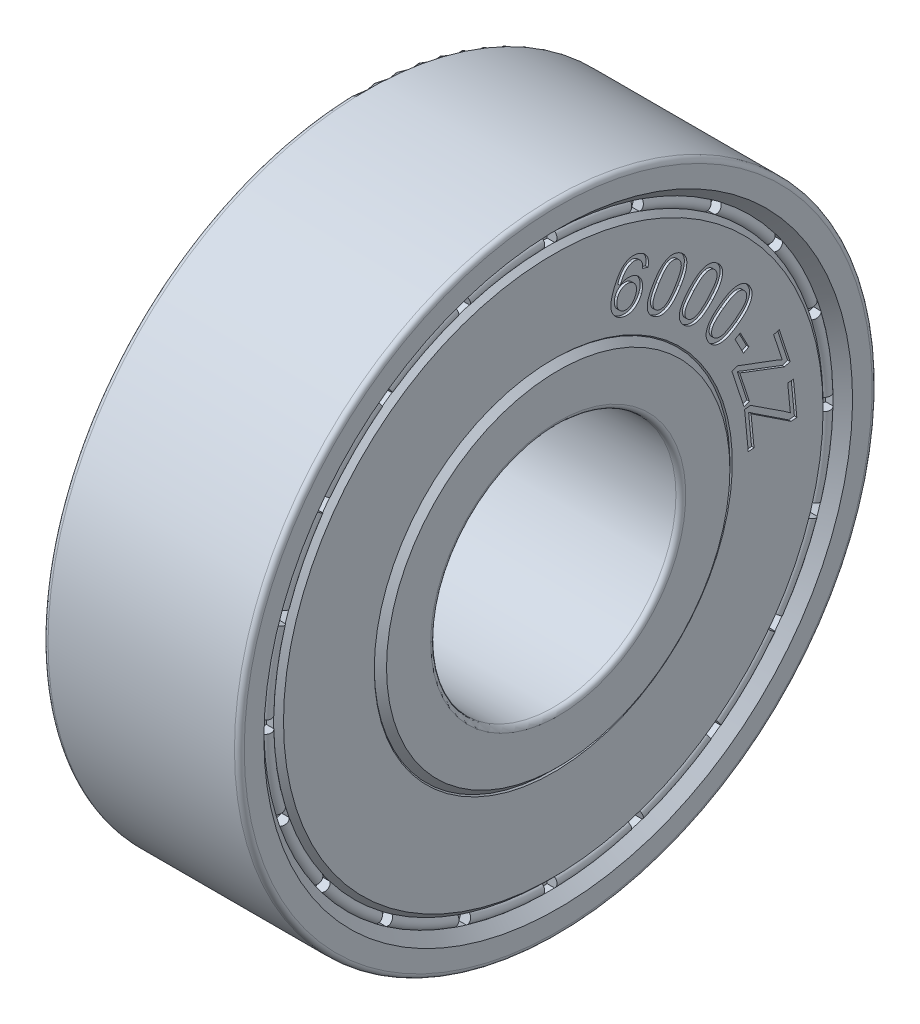
from build123d import *

# Parameters (mm, degrees)
FILLET_1_R                       = 0.2
CUT_EXTRUDE_1_DEPTH              = 0.5
PATTERN_CIRCULAR_1_COUNT         = 20
PATTERN_CIRCULAR_1_COPY_1_DEPTH  = 0.5
PATTERN_CIRCULAR_1_COPY_2_DEPTH  = 0.5
PATTERN_CIRCULAR_1_COPY_3_DEPTH  = 0.5
PATTERN_CIRCULAR_1_COPY_4_DEPTH  = 0.5
PATTERN_CIRCULAR_1_COPY_5_DEPTH  = 0.5
PATTERN_CIRCULAR_1_COPY_6_DEPTH  = 0.5
PATTERN_CIRCULAR_1_COPY_7_DEPTH  = 0.5
PATTERN_CIRCULAR_1_COPY_8_DEPTH  = 0.5
PATTERN_CIRCULAR_1_COPY_9_DEPTH  = 0.5
PATTERN_CIRCULAR_1_COPY_10_DEPTH = 0.5
PATTERN_CIRCULAR_1_COPY_11_DEPTH = 0.5
PATTERN_CIRCULAR_1_COPY_12_DEPTH = 0.5
PATTERN_CIRCULAR_1_COPY_13_DEPTH = 0.5
PATTERN_CIRCULAR_1_COPY_14_DEPTH = 0.5
PATTERN_CIRCULAR_1_COPY_15_DEPTH = 0.5
PATTERN_CIRCULAR_1_COPY_16_DEPTH = 0.5
PATTERN_CIRCULAR_1_COPY_17_DEPTH = 0.5
PATTERN_CIRCULAR_1_COPY_18_DEPTH = 0.5
PATTERN_CIRCULAR_1_COPY_19_DEPTH = 0.5
CUT_EXTRUDE_2_DEPTH              = 0.1


with BuildPart() as part:
    # Эскиз1 → Повернуть1 (revolve)
    with BuildSketch(Plane.XY, mode=Mode.PRIVATE) as revolve_1_sk:
        with BuildLine():
            Line((-4, 5), (4, 5))
            Line((4, 5), (4, 7))
            Line((4, 7), (3.75, 7.25))
            Line((3.75, 7.25), (3.8, 7.3))
            Line((3.8, 7.3), (3.8, 11))
            Line((3.8, 11), (3.6, 11.2))
            ThreePointArc((3.6, 11.2), (3.7, 11.4), (3.6, 11.6))
            Line((3.6, 11.6), (4, 12))
            Line((4, 12), (4, 13))
            Line((4, 13), (-4, 13))
            Line((-4, 13), (-4, 12))
            Line((-4, 12), (-3.6, 11.6))
            ThreePointArc((-3.6, 11.6), (-3.7, 11.4), (-3.6, 11.2))
            Line((-3.6, 11.2), (-3.8, 11))
            Line((-3.8, 11), (-3.8, 7.3))
            Line((-3.8, 7.3), (-3.75, 7.25))
            Line((-3.75, 7.25), (-4, 7))
            Line((-4, 7), (-4, 5))
        make_face()
    revolve(revolve_1_sk.sketch.rotate(Axis((-17.019189765, 0, 0), (1, 0, 0)), 90), axis=Axis((-17.019189765, 0, 0), (1, 0, 0)))

    # Скругление1
    fillet_1_edges = [part.edges().sort_by_distance(p)[0] for p in [
        (-4, 0, -13),
        (4, 0, -13),
        (4, 0, -5),
        (-4, 0, -5),
    ]]
    fillet(fillet_1_edges, radius=FILLET_1_R)

    # Эскиз2 → Вырез-Вытянуть1 (cut)
    with BuildSketch(Plane.ZY.offset(3.8)):
        with BuildLine():
            Line((-0.25, 11.597305722), (-0.25, 11.197209474))
            ThreePointArc((-0.25, 11.197209474), (0, 11.2), (0.25, 11.197209474))
            Line((0.25, 11.197209474), (0.25, 11.597305722))
            ThreePointArc((0.25, 11.597305722), (0, 11.6), (-0.25, 11.597305722))
        make_face()
    cut_extrude_1 = extrude(amount=-CUT_EXTRUDE_1_DEPTH, mode=Mode.SUBTRACT)

    # Зеркальное отражение1: Вырез-Вытянуть1 across plane
    add(cut_extrude_1.mirror(Plane(origin=(0, 0, 0), x_dir=(0, 0, 1), z_dir=(1, 0, 0))), mode=Mode.SUBTRACT)

    # Круговой массив1: Вырез-Вытянуть1 ×20 about axis
    pattern_circular_1_axis = Axis((0, 0, 0), (1, 0, 0))
    for i in range(1, PATTERN_CIRCULAR_1_COUNT):
        add(cut_extrude_1.rotate(pattern_circular_1_axis, i * 360 / PATTERN_CIRCULAR_1_COUNT), mode=Mode.SUBTRACT)

    # Круговой массив1 copy 1 sketch → Круговой массив1 copy 1 (cut)
    with BuildSketch(Plane(origin=(3.8, 0, 0), x_dir=(0, -0.3090169943749474, 0.9510565162951535), z_dir=(1, 0, 0))):
        with BuildLine():
            Line((-0.25, -11.597305722), (-0.25, -11.197209474))
            ThreePointArc((-0.25, -11.197209474), (0, -11.2), (0.25, -11.197209474))
            Line((0.25, -11.197209474), (0.25, -11.597305722))
            ThreePointArc((0.25, -11.597305722), (0, -11.6), (-0.25, -11.597305722))
        make_face()
    extrude(amount=-PATTERN_CIRCULAR_1_COPY_1_DEPTH, mode=Mode.SUBTRACT)

    # Круговой массив1 copy 2 sketch → Круговой массив1 copy 2 (cut)
    with BuildSketch(Plane(origin=(3.8, 0, 0), x_dir=(0, -0.5877852522924731, 0.8090169943749475), z_dir=(1, 0, 0))):
        with BuildLine():
            Line((-0.25, -11.597305722), (-0.25, -11.197209474))
            ThreePointArc((-0.25, -11.197209474), (0, -11.2), (0.25, -11.197209474))
            Line((0.25, -11.197209474), (0.25, -11.597305722))
            ThreePointArc((0.25, -11.597305722), (0, -11.6), (-0.25, -11.597305722))
        make_face()
    extrude(amount=-PATTERN_CIRCULAR_1_COPY_2_DEPTH, mode=Mode.SUBTRACT)

    # Круговой массив1 copy 3 sketch → Круговой массив1 copy 3 (cut)
    with BuildSketch(Plane(origin=(3.8, 0, 0), x_dir=(0, -0.8090169943749475, 0.5877852522924731), z_dir=(1, 0, 0))):
        with BuildLine():
            Line((-0.25, -11.597305722), (-0.25, -11.197209474))
            ThreePointArc((-0.25, -11.197209474), (0, -11.2), (0.25, -11.197209474))
            Line((0.25, -11.197209474), (0.25, -11.597305722))
            ThreePointArc((0.25, -11.597305722), (0, -11.6), (-0.25, -11.597305722))
        make_face()
    extrude(amount=-PATTERN_CIRCULAR_1_COPY_3_DEPTH, mode=Mode.SUBTRACT)

    # Круговой массив1 copy 4 sketch → Круговой массив1 copy 4 (cut)
    with BuildSketch(Plane(origin=(3.8, 0, 0), x_dir=(0, -0.9510565162951535, 0.30901699437494745), z_dir=(1, 0, 0))):
        with BuildLine():
            Line((-0.25, -11.597305722), (-0.25, -11.197209474))
            ThreePointArc((-0.25, -11.197209474), (0, -11.2), (0.25, -11.197209474))
            Line((0.25, -11.197209474), (0.25, -11.597305722))
            ThreePointArc((0.25, -11.597305722), (0, -11.6), (-0.25, -11.597305722))
        make_face()
    extrude(amount=-PATTERN_CIRCULAR_1_COPY_4_DEPTH, mode=Mode.SUBTRACT)

    # Круговой массив1 copy 5 sketch → Круговой массив1 copy 5 (cut)
    with BuildSketch(Plane(origin=(3.8, 0, 0), x_dir=(0, -1, 0), z_dir=(1, 0, 0))):
        with BuildLine():
            Line((-0.25, -11.597305722), (-0.25, -11.197209474))
            ThreePointArc((-0.25, -11.197209474), (0, -11.2), (0.25, -11.197209474))
            Line((0.25, -11.197209474), (0.25, -11.597305722))
            ThreePointArc((0.25, -11.597305722), (0, -11.6), (-0.25, -11.597305722))
        make_face()
    extrude(amount=-PATTERN_CIRCULAR_1_COPY_5_DEPTH, mode=Mode.SUBTRACT)

    # Круговой массив1 copy 6 sketch → Круговой массив1 copy 6 (cut)
    with BuildSketch(Plane(origin=(3.8, 0, 0), x_dir=(0, -0.9510565162951536, -0.30901699437494734), z_dir=(1, 0, 0))):
        with BuildLine():
            Line((-0.25, -11.597305722), (-0.25, -11.197209474))
            ThreePointArc((-0.25, -11.197209474), (0, -11.2), (0.25, -11.197209474))
            Line((0.25, -11.197209474), (0.25, -11.597305722))
            ThreePointArc((0.25, -11.597305722), (0, -11.6), (-0.25, -11.597305722))
        make_face()
    extrude(amount=-PATTERN_CIRCULAR_1_COPY_6_DEPTH, mode=Mode.SUBTRACT)

    # Круговой массив1 copy 7 sketch → Круговой массив1 copy 7 (cut)
    with BuildSketch(Plane(origin=(3.8, 0, 0), x_dir=(0, -0.8090169943749475, -0.587785252292473), z_dir=(1, 0, 0))):
        with BuildLine():
            Line((-0.25, -11.597305722), (-0.25, -11.197209474))
            ThreePointArc((-0.25, -11.197209474), (0, -11.2), (0.25, -11.197209474))
            Line((0.25, -11.197209474), (0.25, -11.597305722))
            ThreePointArc((0.25, -11.597305722), (0, -11.6), (-0.25, -11.597305722))
        make_face()
    extrude(amount=-PATTERN_CIRCULAR_1_COPY_7_DEPTH, mode=Mode.SUBTRACT)

    # Круговой массив1 copy 8 sketch → Круговой массив1 copy 8 (cut)
    with BuildSketch(Plane(origin=(3.8, 0, 0), x_dir=(0, -0.5877852522924732, -0.8090169943749473), z_dir=(1, 0, 0))):
        with BuildLine():
            Line((-0.25, -11.597305722), (-0.25, -11.197209474))
            ThreePointArc((-0.25, -11.197209474), (0, -11.2), (0.25, -11.197209474))
            Line((0.25, -11.197209474), (0.25, -11.597305722))
            ThreePointArc((0.25, -11.597305722), (0, -11.6), (-0.25, -11.597305722))
        make_face()
    extrude(amount=-PATTERN_CIRCULAR_1_COPY_8_DEPTH, mode=Mode.SUBTRACT)

    # Круговой массив1 copy 9 sketch → Круговой массив1 copy 9 (cut)
    with BuildSketch(Plane(origin=(3.8, 0, 0), x_dir=(0, -0.3090169943749475, -0.9510565162951535), z_dir=(1, 0, 0))):
        with BuildLine():
            Line((-0.25, -11.597305722), (-0.25, -11.197209474))
            ThreePointArc((-0.25, -11.197209474), (0, -11.2), (0.25, -11.197209474))
            Line((0.25, -11.197209474), (0.25, -11.597305722))
            ThreePointArc((0.25, -11.597305722), (0, -11.6), (-0.25, -11.597305722))
        make_face()
    extrude(amount=-PATTERN_CIRCULAR_1_COPY_9_DEPTH, mode=Mode.SUBTRACT)

    # Круговой массив1 copy 10 sketch → Круговой массив1 copy 10 (cut)
    with BuildSketch(Plane(origin=(3.8, 0, 0), x_dir=(0, 0, -1), z_dir=(1, 0, 0))):
        with BuildLine():
            Line((-0.25, -11.597305722), (-0.25, -11.197209474))
            ThreePointArc((-0.25, -11.197209474), (0, -11.2), (0.25, -11.197209474))
            Line((0.25, -11.197209474), (0.25, -11.597305722))
            ThreePointArc((0.25, -11.597305722), (0, -11.6), (-0.25, -11.597305722))
        make_face()
    extrude(amount=-PATTERN_CIRCULAR_1_COPY_10_DEPTH, mode=Mode.SUBTRACT)

    # Круговой массив1 copy 11 sketch → Круговой массив1 copy 11 (cut)
    with BuildSketch(Plane(origin=(3.8, 0, 0), x_dir=(0, 0.3090169943749473, -0.9510565162951536), z_dir=(1, 0, 0))):
        with BuildLine():
            Line((-0.25, -11.597305722), (-0.25, -11.197209474))
            ThreePointArc((-0.25, -11.197209474), (0, -11.2), (0.25, -11.197209474))
            Line((0.25, -11.197209474), (0.25, -11.597305722))
            ThreePointArc((0.25, -11.597305722), (0, -11.6), (-0.25, -11.597305722))
        make_face()
    extrude(amount=-PATTERN_CIRCULAR_1_COPY_11_DEPTH, mode=Mode.SUBTRACT)

    # Круговой массив1 copy 12 sketch → Круговой массив1 copy 12 (cut)
    with BuildSketch(Plane(origin=(3.8, 0, 0), x_dir=(0, 0.587785252292473, -0.8090169943749476), z_dir=(1, 0, 0))):
        with BuildLine():
            Line((-0.25, -11.597305722), (-0.25, -11.197209474))
            ThreePointArc((-0.25, -11.197209474), (0, -11.2), (0.25, -11.197209474))
            Line((0.25, -11.197209474), (0.25, -11.597305722))
            ThreePointArc((0.25, -11.597305722), (0, -11.6), (-0.25, -11.597305722))
        make_face()
    extrude(amount=-PATTERN_CIRCULAR_1_COPY_12_DEPTH, mode=Mode.SUBTRACT)

    # Круговой массив1 copy 13 sketch → Круговой массив1 copy 13 (cut)
    with BuildSketch(Plane(origin=(3.8, 0, 0), x_dir=(0, 0.8090169943749473, -0.5877852522924732), z_dir=(1, 0, 0))):
        with BuildLine():
            Line((-0.25, -11.597305722), (-0.25, -11.197209474))
            ThreePointArc((-0.25, -11.197209474), (0, -11.2), (0.25, -11.197209474))
            Line((0.25, -11.197209474), (0.25, -11.597305722))
            ThreePointArc((0.25, -11.597305722), (0, -11.6), (-0.25, -11.597305722))
        make_face()
    extrude(amount=-PATTERN_CIRCULAR_1_COPY_13_DEPTH, mode=Mode.SUBTRACT)

    # Круговой массив1 copy 14 sketch → Круговой массив1 copy 14 (cut)
    with BuildSketch(Plane(origin=(3.8, 0, 0), x_dir=(0, 0.9510565162951535, -0.30901699437494756), z_dir=(1, 0, 0))):
        with BuildLine():
            Line((-0.25, -11.597305722), (-0.25, -11.197209474))
            ThreePointArc((-0.25, -11.197209474), (0, -11.2), (0.25, -11.197209474))
            Line((0.25, -11.197209474), (0.25, -11.597305722))
            ThreePointArc((0.25, -11.597305722), (0, -11.6), (-0.25, -11.597305722))
        make_face()
    extrude(amount=-PATTERN_CIRCULAR_1_COPY_14_DEPTH, mode=Mode.SUBTRACT)

    # Круговой массив1 copy 15 sketch → Круговой массив1 copy 15 (cut)
    with BuildSketch(Plane.YZ.offset(3.8)):
        with BuildLine():
            Line((-0.25, -11.597305722), (-0.25, -11.197209474))
            ThreePointArc((-0.25, -11.197209474), (0, -11.2), (0.25, -11.197209474))
            Line((0.25, -11.197209474), (0.25, -11.597305722))
            ThreePointArc((0.25, -11.597305722), (0, -11.6), (-0.25, -11.597305722))
        make_face()
    extrude(amount=-PATTERN_CIRCULAR_1_COPY_15_DEPTH, mode=Mode.SUBTRACT)

    # Круговой массив1 copy 16 sketch → Круговой массив1 copy 16 (cut)
    with BuildSketch(Plane(origin=(3.8, 0, 0), x_dir=(0, 0.9510565162951536, 0.30901699437494723), z_dir=(1, 0, 0))):
        with BuildLine():
            Line((-0.25, -11.597305722), (-0.25, -11.197209474))
            ThreePointArc((-0.25, -11.197209474), (0, -11.2), (0.25, -11.197209474))
            Line((0.25, -11.197209474), (0.25, -11.597305722))
            ThreePointArc((0.25, -11.597305722), (0, -11.6), (-0.25, -11.597305722))
        make_face()
    extrude(amount=-PATTERN_CIRCULAR_1_COPY_16_DEPTH, mode=Mode.SUBTRACT)

    # Круговой массив1 copy 17 sketch → Круговой массив1 copy 17 (cut)
    with BuildSketch(Plane(origin=(3.8, 0, 0), x_dir=(0, 0.8090169943749476, 0.5877852522924729), z_dir=(1, 0, 0))):
        with BuildLine():
            Line((-0.25, -11.597305722), (-0.25, -11.197209474))
            ThreePointArc((-0.25, -11.197209474), (0, -11.2), (0.25, -11.197209474))
            Line((0.25, -11.197209474), (0.25, -11.597305722))
            ThreePointArc((0.25, -11.597305722), (0, -11.6), (-0.25, -11.597305722))
        make_face()
    extrude(amount=-PATTERN_CIRCULAR_1_COPY_17_DEPTH, mode=Mode.SUBTRACT)

    # Круговой массив1 copy 18 sketch → Круговой массив1 copy 18 (cut)
    with BuildSketch(Plane(origin=(3.8, 0, 0), x_dir=(0, 0.5877852522924734, 0.8090169943749473), z_dir=(1, 0, 0))):
        with BuildLine():
            Line((-0.25, -11.597305722), (-0.25, -11.197209474))
            ThreePointArc((-0.25, -11.197209474), (0, -11.2), (0.25, -11.197209474))
            Line((0.25, -11.197209474), (0.25, -11.597305722))
            ThreePointArc((0.25, -11.597305722), (0, -11.6), (-0.25, -11.597305722))
        make_face()
    extrude(amount=-PATTERN_CIRCULAR_1_COPY_18_DEPTH, mode=Mode.SUBTRACT)

    # Круговой массив1 copy 19 sketch → Круговой массив1 copy 19 (cut)
    with BuildSketch(Plane(origin=(3.8, 0, 0), x_dir=(0, 0.3090169943749476, 0.9510565162951535), z_dir=(1, 0, 0))):
        with BuildLine():
            Line((-0.25, -11.597305722), (-0.25, -11.197209474))
            ThreePointArc((-0.25, -11.197209474), (0, -11.2), (0.25, -11.197209474))
            Line((0.25, -11.197209474), (0.25, -11.597305722))
            ThreePointArc((0.25, -11.597305722), (0, -11.6), (-0.25, -11.597305722))
        make_face()
    extrude(amount=-PATTERN_CIRCULAR_1_COPY_19_DEPTH, mode=Mode.SUBTRACT)

    # Эскиз3 → Вырез-Вытянуть2 (cut)
    # profile 1 of 7: a face of its own
    with BuildSketch(Plane(origin=(3.8, 0, 0), x_dir=(0, 0, -1), z_dir=(1, 0, 0))):
        with BuildLine():
            Line((7.798095009, 1.622756474), (8.041684753, 1.646394295))
            Line((8.041684753, 1.646394295), (9.409072574, 0.752564167))
            add(Edge.make_bspline(
                [(9.409072574, 0.752564167), (9.432646646, 0.737043094), (9.4786549, 0.70675145), (9.544714248, 0.660755772), (9.606234203, 0.615373038), (9.645253648, 0.584786792), (9.664280907, 0.569871859)],
                knots=[0, 0, 0, 0, 1.078692827, 2.105226937, 3.076041761, 4, 4, 4, 4], degree=3))
            Line((9.664280907, 0.569871859), (9.557710394, 1.676041731))
            Line((9.557710394, 1.676041731), (9.791684753, 1.698477628))
            Line((9.791684753, 1.698477628), (9.928303343, 0.278605833))
            Line((9.928303343, 0.278605833), (9.694328984, 0.256169936))
            Line((9.694328984, 0.256169936), (8.21235783, 1.236939167))
            Line((8.21235783, 1.236939167), (8.061316163, 1.343509679))
            Line((8.061316163, 1.343509679), (8.183111035, 0.077884679))
            Line((8.183111035, 0.077884679), (7.949136676, 0.055448782))
            Line((7.949136676, 0.055448782), (7.798095009, 1.622756474))
        make_face()
    # profile 2 of 7: a face of its own
    with BuildSketch(Plane(origin=(3.8, 0, 0), x_dir=(0, 0, -1), z_dir=(1, 0, 0))):
        with BuildLine():
            Line((7.281845001, 3.22892145), (7.513816155, 3.305043245))
            Line((7.513816155, 3.305043245), (9.04346359, 2.734931066))
            add(Edge.make_bspline(
                [(9.04346359, 2.734931066), (9.069948947, 2.724892425), (9.121526358, 2.705343242), (9.196150225, 2.674944176), (9.265963794, 2.64407808), (9.310606871, 2.622723793), (9.33232577, 2.612334912)],
                knots=[0, 0, 0, 0, 1.082672182, 2.108388783, 3.079729354, 4, 4, 4, 4], degree=3))
            Line((9.33232577, 2.612334912), (8.985370642, 3.667222732))
            Line((8.985370642, 3.667222732), (9.208527693, 3.74054004))
            Line((9.208527693, 3.74054004), (9.653639872, 2.386774015))
            Line((9.653639872, 2.386774015), (9.430482821, 2.313456707))
            Line((9.430482821, 2.313456707), (7.76982577, 2.94366504))
            Line((7.76982577, 2.94366504), (7.599553334, 3.014578502))
            Line((7.599553334, 3.014578502), (7.99658859, 1.807447091))
            Line((7.99658859, 1.807447091), (7.773431539, 1.734129784))
            Line((7.773431539, 1.734129784), (7.281845001, 3.22892145))
        make_face()
    # profile 3 of 7: a face of its own
    with BuildSketch(Plane(origin=(3.8, 0, 0), x_dir=(0, 0, -1), z_dir=(1, 0, 0))):
        Polygon((7.407100162, 4.296491824), (7.624648239, 4.410273875), (7.972004008, 3.745610414), (7.754455931, 3.631828363), align=None)
    # profile 4 of 7: a face of its own
    with BuildSketch(Plane(origin=(3.8, 0, 0), x_dir=(0, 0, -1), z_dir=(1, 0, 0))):
        with BuildLine():
            add(Edge.make_bspline(
                [(6.780901094, 5.823533545), (6.804056337, 5.840341537), (6.84930453, 5.873186421), (6.916762866, 5.919240387), (6.982445273, 5.960673153), (7.045746763, 5.998014328), (7.10732028, 6.030313989), (7.16616257, 6.059341836), (7.223530875, 6.082661748), (7.278631644, 6.102671161), (7.332187931, 6.118314548), (7.384467593, 6.130499012), (7.435598656, 6.138891282), (7.485651857, 6.143823779), (7.534395425, 6.145057357), (7.582081333, 6.142673852), (7.628562819, 6.136656013), (7.674071851, 6.12715941), (7.718096047, 6.113375408), (7.760967768, 6.096315155), (7.801745491, 6.074340359), (7.841406871, 6.049123037), (7.879079236, 6.019267801), (7.915015635, 5.985307419), (7.950364613, 5.948248434), (7.971333219, 5.92057433), (7.982022889, 5.906466237)],
                knots=[0, 0, 0, 0, 1.514460834, 2.95944262, 4.322424192, 5.624507893, 6.848251242, 8.002224061, 9.095722889, 10.124230244, 11.103969829, 12.047068155, 12.96397351, 13.844602202, 14.707259037, 15.542457491, 16.369267821, 17.185861967, 17.999728556, 18.808328741, 19.62415764, 20.447698018, 21.293360642, 22.163601103, 23.063814808, 24, 24, 24, 24], degree=3))
            add(Edge.make_bspline(
                [(7.982022889, 5.906466237), (7.996851151, 5.885299939), (8.025710094, 5.844105836), (8.059114634, 5.77799641), (8.083485272, 5.711168211), (8.098505208, 5.643396197), (8.104048995, 5.575349359), (8.100916036, 5.507031394), (8.088165864, 5.438866772), (8.067027288, 5.37051628), (8.037409667, 5.302421004), (8.000117203, 5.233672034), (7.95469337, 5.164751133), (7.911061948, 5.107146706), (7.870802363, 5.060882237), (7.836941034, 5.023934963), (7.798773113, 4.986448503), (7.756810789, 4.947863841), (7.711203217, 4.907828531), (7.661588237, 4.866576679), (7.607805992, 4.824635598), (7.570477011, 4.796629658), (7.551333786, 4.782267519)],
                knots=[0, 0, 0, 0, 1.139247292, 2.217216721, 3.25744176, 4.271238646, 5.270613102, 6.261804622, 7.280181733, 8.32222481, 9.412543763, 10.551699595, 11.769455439, 13.051875211, 13.737118517, 14.475284601, 15.262891191, 16.096992133, 16.990673301, 17.940660638, 18.943919811, 20, 20, 20, 20], degree=3))
            add(Edge.make_bspline(
                [(7.551333786, 4.782267519), (7.528358175, 4.765392162), (7.483587473, 4.73250853), (7.416020074, 4.687476351), (7.351029499, 4.645875405), (7.288061707, 4.608654394), (7.226782799, 4.576016929), (7.167738936, 4.547594161), (7.110717096, 4.523332702), (7.055586981, 4.503577226), (7.002056012, 4.487870611), (6.94989403, 4.47575373), (6.898913715, 4.467283825), (6.848984021, 4.462341028), (6.800122489, 4.461296931), (6.752280708, 4.462977398), (6.705660646, 4.469135191), (6.660264187, 4.478801139), (6.615944018, 4.491759695), (6.573515703, 4.509745058), (6.532219076, 4.530848154), (6.492942565, 4.556910152), (6.45477506, 4.586366748), (6.41868986, 4.620517221), (6.383607473, 4.65804724), (6.362280618, 4.685663907), (6.351413914, 4.699735468)],
                knots=[0, 0, 0, 0, 1.509931901, 2.942281244, 4.300377417, 5.597400603, 6.815874636, 7.977144608, 9.067715429, 10.097045193, 11.077568191, 12.021420632, 12.932078734, 13.813411589, 14.676758217, 15.519363309, 16.346834769, 17.164081874, 17.976538222, 18.788470792, 19.601666016, 20.429711867, 21.281620616, 22.152556933, 23.058669636, 24, 24, 24, 24], degree=3))
            add(Edge.make_bspline(
                [(6.351413914, 4.699735468), (6.338069446, 4.71885043), (6.311959581, 4.75625088), (6.280156685, 4.815462774), (6.256020975, 4.875436611), (6.238756832, 4.93608877), (6.229564463, 4.997620524), (6.227980317, 5.059766415), (6.23395303, 5.122613177), (6.243559717, 5.163898847), (6.248449171, 5.18491175)],
                knots=[0, 0, 0, 0, 1.087244517, 2.127309101, 3.12838263, 4.099180706, 5.063435128, 6.02353161, 6.994049576, 8, 8, 8, 8], degree=3))
            add(Edge.make_bspline(
                [(6.248449171, 5.18491175), (6.256625499, 5.210798922), (6.273483431, 5.26417303), (6.312289941, 5.342177371), (6.361961533, 5.420954396), (6.423373797, 5.500399057), (6.496452557, 5.5803941), (6.580277523, 5.661825186), (6.676051881, 5.743505204), (6.745116555, 5.796220252), (6.780901094, 5.823533545)],
                knots=[0, 0, 0, 0, 0.769321166, 1.586184438, 2.463009893, 3.408867134, 4.430989796, 5.535022541, 6.722819113, 8, 8, 8, 8], degree=3))
        make_face()
        with BuildLine():
            add(Edge.make_bspline(
                [(6.929939555, 5.622011109), (6.898650679, 5.598462206), (6.838928393, 5.553513506), (6.755987529, 5.485569009), (6.683397977, 5.420883303), (6.620921908, 5.359335784), (6.569121165, 5.3007416), (6.526582606, 5.246069873), (6.49526586, 5.193694998), (6.473816021, 5.144110362), (6.461163705, 5.096825656), (6.452843208, 5.052085065), (6.449867363, 5.008768271), (6.452377841, 4.967222674), (6.459333262, 4.927249526), (6.472251917, 4.889190301), (6.489124483, 4.852340381), (6.504638919, 4.830003134), (6.512471607, 4.818725852)],
                knots=[0, 0, 0, 0, 1.863115384, 3.556200181, 5.099687688, 6.488055278, 7.726009687, 8.8189451, 9.779013455, 10.621701707, 11.380193532, 12.103118066, 12.784467443, 13.440056271, 14.079432119, 14.708366397, 15.347900096, 16, 16, 16, 16], degree=3))
            add(Edge.make_bspline(
                [(6.512471607, 4.818725852), (6.521000467, 4.807918924), (6.537855785, 4.786561533), (6.567967793, 4.759204646), (6.601067515, 4.736107339), (6.637390873, 4.717679995), (6.676556267, 4.70356921), (6.718817974, 4.694052735), (6.764033272, 4.688428498), (6.813073706, 4.687591052), (6.866874893, 4.693021706), (6.925741581, 4.70900706), (6.990841485, 4.732288812), (7.061800677, 4.765249349), (7.138502519, 4.807316153), (7.221645637, 4.857503434), (7.310487782, 4.916986273), (7.370798103, 4.960871028), (7.402295324, 4.983789955)],
                knots=[0, 0, 0, 0, 0.654418374, 1.293306335, 1.928164818, 2.570711166, 3.226271014, 3.904793127, 4.628645959, 5.391612642, 6.235465974, 7.192954128, 8.286831286, 9.524277468, 10.912413863, 12.449667111, 14.145829439, 16, 16, 16, 16], degree=3))
            add(Edge.make_bspline(
                [(7.402295324, 4.983789955), (7.433583724, 5.007338678), (7.493455282, 5.052400068), (7.576540992, 5.120474838), (7.649092176, 5.185471889), (7.71218893, 5.246371876), (7.763994006, 5.304915579), (7.805908228, 5.359996617), (7.837844115, 5.41178872), (7.858800354, 5.461497883), (7.871440508, 5.508566936), (7.879961996, 5.553303993), (7.882169587, 5.596768488), (7.880107903, 5.63851378), (7.872151424, 5.67869076), (7.860007033, 5.717438877), (7.841550763, 5.754293426), (7.826040795, 5.777093723), (7.818160709, 5.788677775)],
                knots=[0, 0, 0, 0, 1.858590664, 3.556484911, 5.096223939, 6.48127779, 7.716225732, 8.802685937, 9.763668522, 10.596000405, 11.352650174, 12.073819029, 12.753129345, 13.413454137, 14.052441554, 14.691900397, 15.335399254, 16, 16, 16, 16], degree=3))
            add(Edge.make_bspline(
                [(7.818160709, 5.788677775), (7.809758424, 5.799475118), (7.793222268, 5.820724879), (7.764045842, 5.847847854), (7.733069138, 5.870938322), (7.699772821, 5.889788827), (7.663904476, 5.903539142), (7.625977298, 5.913896423), (7.585527606, 5.918927482), (7.557888552, 5.919165004), (7.543721607, 5.91928675)],
                knots=[0, 0, 0, 0, 1.034742465, 2.036429693, 3.005412194, 3.956384873, 4.923676673, 5.907484852, 6.927439899, 8, 8, 8, 8], degree=3))
            add(Edge.make_bspline(
                [(7.543721607, 5.91928675), (7.524417558, 5.917785256), (7.483476733, 5.914600825), (7.419822523, 5.89874069), (7.351113244, 5.874406113), (7.276856117, 5.841446402), (7.197463027, 5.799681622), (7.112689954, 5.748764771), (7.022709117, 5.688923468), (6.961708728, 5.644925417), (6.929939555, 5.622011109)],
                knots=[0, 0, 0, 0, 0.671942086, 1.425082606, 2.27053705, 3.203593418, 4.245705292, 5.386305713, 6.638780733, 8, 8, 8, 8], degree=3))
        make_face(mode=Mode.SUBTRACT)
    # profile 5 of 7: a face of its own
    with BuildSketch(Plane(origin=(3.8, 0, 0), x_dir=(0, 0, -1), z_dir=(1, 0, 0))):
        with BuildLine():
            add(Edge.make_bspline(
                [(5.541482798, 7.01639338), (5.560938142, 7.037529672), (5.598878976, 7.078748605), (5.657290294, 7.136189742), (5.713744162, 7.189687441), (5.768774656, 7.238682128), (5.823115259, 7.282412178), (5.8758375, 7.321667208), (5.927216178, 7.356557807), (5.977922053, 7.38603833), (6.027439022, 7.412200407), (6.076725222, 7.433621871), (6.125357598, 7.45183376), (6.173475992, 7.466456514), (6.221335979, 7.476779587), (6.268705629, 7.483829951), (6.315752951, 7.486490543), (6.362245846, 7.485839676), (6.408278218, 7.481079851), (6.453445695, 7.471789045), (6.497996384, 7.458475793), (6.541541636, 7.440816498), (6.584409009, 7.418926029), (6.626493044, 7.392817318), (6.667833086, 7.362322178), (6.694020766, 7.3393715), (6.707348182, 7.327691457)],
                knots=[0, 0, 0, 0, 1.516954679, 2.958288658, 4.325387066, 5.624534111, 6.848320754, 8.007861823, 9.095501658, 10.126121407, 11.104061732, 12.051514618, 12.962045896, 13.845682454, 14.704799287, 15.545656121, 16.372342793, 17.190622366, 17.999116481, 18.81245688, 19.622457057, 20.451517242, 21.290567722, 22.161559593, 23.064382154, 24, 24, 24, 24], degree=3))
            add(Edge.make_bspline(
                [(6.707348182, 7.327691457), (6.725941793, 7.309527856), (6.762171145, 7.27413637), (6.808060607, 7.215611725), (6.84517089, 7.15468851), (6.872512021, 7.090933576), (6.891010702, 7.025044658), (6.901327569, 6.9573413), (6.901788273, 6.887834328), (6.89390252, 6.81680236), (6.878090544, 6.743935557), (6.853955784, 6.669367422), (6.823097796, 6.592486549), (6.790768762, 6.527860523), (6.76082361, 6.474186445), (6.733678658, 6.432026797), (6.703869854, 6.387304746), (6.669479394, 6.341494367), (6.632249945, 6.29327901), (6.591449222, 6.243130492), (6.546410277, 6.191663711), (6.515082539, 6.156846791), (6.499014849, 6.138989534)],
                knots=[0, 0, 0, 0, 1.143043865, 2.22720266, 3.263474838, 4.274535387, 5.270048047, 6.26840246, 7.27946301, 8.319977347, 9.408286885, 10.555253355, 11.765721866, 13.051147184, 13.732827105, 14.469907207, 15.257321315, 16.097876083, 16.990246992, 17.938552126, 18.942703551, 20, 20, 20, 20], degree=3))
            add(Edge.make_bspline(
                [(6.499014849, 6.138989534), (6.47965629, 6.118155723), (6.44178353, 6.077396806), (6.384014096, 6.019996597), (6.328069433, 5.96650987), (6.273183961, 5.917771399), (6.218993985, 5.874346443), (6.166615192, 5.834597568), (6.114848941, 5.800385512), (6.06466417, 5.769904357), (6.014928923, 5.744133648), (5.965885235, 5.7220516), (5.917126888, 5.703986986), (5.868908996, 5.689263914), (5.820888242, 5.679016483), (5.773378216, 5.672091179), (5.726366041, 5.668755124), (5.679713422, 5.669566589), (5.633735919, 5.674369878), (5.588293472, 5.683077798), (5.543881381, 5.696951378), (5.500088187, 5.714667229), (5.456823143, 5.736256662), (5.414911109, 5.763189227), (5.372957438, 5.793284613), (5.346835181, 5.816623308), (5.333550106, 5.828492739)],
                knots=[0, 0, 0, 0, 1.50180831, 2.938112561, 4.300056792, 5.589217896, 6.812975729, 7.966834298, 9.060309876, 10.088440802, 11.066358104, 12.016645834, 12.927155676, 13.810771431, 14.676759723, 15.517596762, 16.344715152, 17.162975462, 17.978465045, 18.783487196, 19.602264075, 20.431304742, 21.276625962, 22.151330223, 23.059816403, 24, 24, 24, 24], degree=3))
            add(Edge.make_bspline(
                [(5.333550106, 5.828492739), (5.316612449, 5.844697469), (5.283609456, 5.876272356), (5.241374646, 5.928690589), (5.205704311, 5.98267123), (5.177888285, 6.039448309), (5.156865415, 6.098142863), (5.143111484, 6.159061427), (5.13702421, 6.222211556), (5.138492746, 6.264785148), (5.139239208, 6.286425431)],
                knots=[0, 0, 0, 0, 1.089699693, 2.123277873, 3.124655211, 4.094534536, 5.057601859, 6.019405378, 6.993257844, 8, 8, 8, 8], degree=3))
            add(Edge.make_bspline(
                [(5.139239208, 6.286425431), (5.142284512, 6.313393103), (5.148576672, 6.369113282), (5.172147759, 6.453150282), (5.20614673, 6.540134855), (5.251625066, 6.62992091), (5.307484491, 6.723041837), (5.375001999, 6.818791339), (5.453070362, 6.917926156), (5.511318727, 6.982798871), (5.541482798, 7.01639338)],
                knots=[0, 0, 0, 0, 0.767179789, 1.585134782, 2.461254147, 3.407993963, 4.430391842, 5.532597474, 6.722249032, 8, 8, 8, 8], degree=3))
        make_face()
        with BuildLine():
            add(Edge.make_bspline(
                [(5.726578952, 6.846521585), (5.700294923, 6.817485093), (5.649944249, 6.761861695), (5.581668023, 6.678899827), (5.52215948, 6.601639519), (5.472867749, 6.529019659), (5.432177419, 6.46199024), (5.401850617, 6.399457968), (5.380115754, 6.342359904), (5.369181637, 6.289260284), (5.365322296, 6.240565372), (5.365880251, 6.194897837), (5.371536133, 6.151904308), (5.381458523, 6.111331473), (5.396380669, 6.073510824), (5.415862287, 6.038225362), (5.439877464, 6.005356935), (5.459459202, 5.986348196), (5.469367413, 5.976729918)],
                knots=[0, 0, 0, 0, 1.859081316, 3.561326153, 5.099435683, 6.486852427, 7.726369688, 8.818053478, 9.782744305, 10.618317351, 11.381746106, 12.098270481, 12.782425094, 13.435930195, 14.07638873, 14.706343083, 15.345419422, 16, 16, 16, 16], degree=3))
            add(Edge.make_bspline(
                [(5.469367413, 5.976729918), (5.479824978, 5.967750302), (5.500531333, 5.949970338), (5.535278635, 5.928761426), (5.572211001, 5.912470177), (5.61135759, 5.901435285), (5.652573975, 5.89438608), (5.696077335, 5.892893271), (5.741628101, 5.897026357), (5.790122523, 5.904565582), (5.841969278, 5.920638562), (5.897110835, 5.947094436), (5.956307718, 5.983270068), (6.020215393, 6.028699173), (6.087595751, 6.08493155), (6.159648755, 6.150274141), (6.236038904, 6.225462562), (6.286895429, 6.280204662), (6.313518054, 6.308861328)],
                knots=[0, 0, 0, 0, 0.653707645, 1.29436468, 1.924769528, 2.565049779, 3.220845952, 3.906240296, 4.625143896, 5.390413909, 6.232955696, 7.191924981, 8.287165042, 9.524241167, 10.911971994, 12.45200836, 14.142679725, 16, 16, 16, 16], degree=3))
            add(Edge.make_bspline(
                [(6.313518054, 6.308861328), (6.33974354, 6.338079946), (6.389977915, 6.394047603), (6.459027886, 6.476756513), (6.518138151, 6.554553104), (6.567790488, 6.62699366), (6.607712551, 6.694443209), (6.638770145, 6.756418625), (6.659941257, 6.813628579), (6.6708891, 6.866514175), (6.67492456, 6.915225557), (6.67368872, 6.960882879), (6.668161562, 7.003867374), (6.658333427, 7.044545058), (6.642786237, 7.082368807), (6.623044645, 7.11797139), (6.598610268, 7.151228014), (6.578766361, 7.170503286), (6.568726388, 7.180255559)],
                knots=[0, 0, 0, 0, 1.859845165, 3.562494968, 5.102361031, 6.486818168, 7.720467442, 8.812592859, 9.767125806, 10.600916426, 11.362716652, 12.077852482, 12.760547671, 13.41265873, 14.054095207, 14.691305997, 15.337869697, 16, 16, 16, 16], degree=3))
            add(Edge.make_bspline(
                [(6.568726388, 7.180255559), (6.558392172, 7.189218998), (6.538110129, 7.206810741), (6.504372332, 7.228025155), (6.469509269, 7.24504959), (6.433015035, 7.257235707), (6.395151641, 7.264433145), (6.355855938, 7.266789115), (6.315117809, 7.264338441), (6.28783637, 7.259339804), (6.273854593, 7.256777995)],
                knots=[0, 0, 0, 0, 1.032460674, 2.026318457, 3.001294144, 3.958718361, 4.924615523, 5.905423827, 6.926526716, 8, 8, 8, 8], degree=3))
            add(Edge.make_bspline(
                [(6.273854593, 7.256777995), (6.255125471, 7.251503122), (6.215366738, 7.240305464), (6.155813642, 7.212492342), (6.092578794, 7.175707929), (6.026204606, 7.128588902), (5.955615896, 7.072550218), (5.882144776, 7.005948709), (5.804706096, 6.930219257), (5.753332906, 6.875183118), (5.726578952, 6.846521585)],
                knots=[0, 0, 0, 0, 0.67338536, 1.429482383, 2.269327317, 3.206584366, 4.247404011, 5.391220388, 6.641408642, 8, 8, 8, 8], degree=3))
        make_face(mode=Mode.SUBTRACT)
    # profile 6 of 7: a face of its own
    with BuildSketch(Plane(origin=(3.8, 0, 0), x_dir=(0, 0, -1), z_dir=(1, 0, 0))):
        with BuildLine():
            add(Edge.make_bspline(
                [(4.087544966, 7.944355991), (4.102609032, 7.968631024), (4.131931415, 8.015882665), (4.177501103, 8.083306611), (4.222236519, 8.146203651), (4.266489779, 8.204517152), (4.311271214, 8.257372637), (4.354979106, 8.306006497), (4.398963474, 8.349336804), (4.442227218, 8.38864226), (4.486050445, 8.423045943), (4.529885772, 8.453750696), (4.573974717, 8.480525225), (4.618081906, 8.504074906), (4.662774105, 8.523291947), (4.707748571, 8.538999921), (4.752982776, 8.551107912), (4.79855318, 8.55922018), (4.844130308, 8.563137536), (4.889892937, 8.563436154), (4.935723455, 8.55827012), (4.981682461, 8.549506761), (5.027811313, 8.536765925), (5.073494176, 8.518634375), (5.119795023, 8.497287673), (5.149650154, 8.479742088), (5.164868684, 8.470798298)],
                knots=[0, 0, 0, 0, 1.518242038, 2.955276198, 4.324085179, 5.620172057, 6.844278623, 8.004928054, 9.094012581, 10.124340396, 11.10978443, 12.052912562, 12.967072836, 13.849691611, 14.708033244, 15.549781275, 16.379594997, 17.194090404, 18.006325169, 18.8083553, 19.621953396, 20.452980386, 21.29338078, 22.160684545, 23.062416499, 24, 24, 24, 24], degree=3))
            add(Edge.make_bspline(
                [(5.164868684, 8.470798298), (5.186454195, 8.456724975), (5.228443669, 8.429348673), (5.284308053, 8.381035037), (5.3319351, 8.328583792), (5.370797896, 8.271407599), (5.401209409, 8.210692589), (5.424200886, 8.146608665), (5.437917259, 8.079018533), (5.443886114, 8.00817028), (5.441854333, 7.934251219), (5.433381545, 7.856917849), (5.417503528, 7.776168971), (5.398401214, 7.706850047), (5.37973383, 7.64861063), (5.361353358, 7.602316745), (5.340510535, 7.553230722), (5.316563179, 7.501733177), (5.289088238, 7.447865536), (5.258485942, 7.391520076), (5.225607865, 7.33210307), (5.201346145, 7.29242389), (5.188907146, 7.27208035)],
                knots=[0, 0, 0, 0, 1.140994483, 2.219533218, 3.263074035, 4.272694423, 5.273252546, 6.265424999, 7.281133953, 8.320722746, 9.410040107, 10.553227765, 11.765094883, 13.053016434, 13.738065336, 14.474498792, 15.259449225, 16.1015227, 16.990920342, 17.938982784, 18.943315161, 20, 20, 20, 20], degree=3))
            add(Edge.make_bspline(
                [(5.188907146, 7.27208035), (5.173966745, 7.24794628), (5.144890883, 7.200978406), (5.099812406, 7.13379373), (5.054961208, 7.071573286), (5.011107402, 7.013327441), (4.966347252, 6.960816969), (4.923084345, 6.911906589), (4.879091931, 6.868692873), (4.835840756, 6.829554393), (4.792410166, 6.794801781), (4.748459825, 6.764552437), (4.705079536, 6.73679908), (4.660529673, 6.714194292), (4.616204622, 6.69421208), (4.571094347, 6.678654608), (4.525832208, 6.666605479), (4.480326187, 6.658074327), (4.434607239, 6.65340098), (4.388719589, 6.654100895), (4.342716092, 6.65840803), (4.296567902, 6.667272206), (4.25043227, 6.680727082), (4.204040134, 6.697860185), (4.15790571, 6.720190606), (4.127770292, 6.737567555), (4.11238471, 6.746439324)],
                knots=[0, 0, 0, 0, 1.509588001, 2.937844405, 4.301904969, 5.589008022, 6.814033676, 7.970788536, 9.060690774, 10.091792184, 11.072409697, 12.016245952, 12.928773453, 13.808764472, 14.670594465, 15.5129745, 16.343411267, 17.159786096, 17.973282161, 18.783048569, 19.596544634, 20.428195579, 21.277999447, 22.150071667, 23.055522515, 24, 24, 24, 24], degree=3))
            add(Edge.make_bspline(
                [(4.11238471, 6.746439324), (4.092878565, 6.759004718), (4.054701073, 6.78359775), (4.003219996, 6.826325354), (3.958347814, 6.872687222), (3.920064659, 6.922501486), (3.888512858, 6.975752593), (3.863903293, 7.032568414), (3.845629281, 7.09281731), (3.838932658, 7.134691219), (3.835541761, 7.155894452)],
                knots=[0, 0, 0, 0, 1.085879002, 2.125285981, 3.124906691, 4.101868537, 5.060786894, 6.015883662, 6.995324705, 8, 8, 8, 8], degree=3))
            add(Edge.make_bspline(
                [(3.835541761, 7.155894452), (3.833403197, 7.182725011), (3.828975694, 7.238272732), (3.835460693, 7.3246583), (3.85189499, 7.415956501), (3.878625261, 7.512180695), (3.916168924, 7.61340303), (3.962982983, 7.719901769), (4.020797804, 7.831181167), (4.064746798, 7.905699986), (4.087544966, 7.944355991)],
                knots=[0, 0, 0, 0, 0.766207616, 1.586291493, 2.459881028, 3.407301389, 4.428407193, 5.534490908, 6.721038075, 8, 8, 8, 8], degree=3))
        make_face()
        with BuildLine():
            add(Edge.make_bspline(
                [(4.300685992, 7.814147657), (4.28065797, 7.780778383), (4.242330052, 7.716919118), (4.191516525, 7.622972997), (4.148259455, 7.536375414), (4.113938168, 7.456222461), (4.087474942, 7.383027153), (4.069498675, 7.316452911), (4.059540951, 7.256560589), (4.058550233, 7.202831949), (4.064882757, 7.154660329), (4.073641927, 7.110215643), (4.087366321, 7.069228541), (4.104979398, 7.031611285), (4.126893874, 6.99759318), (4.152641656, 6.966937838), (4.182579835, 6.939695938), (4.205122686, 6.924709944), (4.216551377, 6.917112401)],
                knots=[0, 0, 0, 0, 1.859661071, 3.558860442, 5.102998429, 6.484052547, 7.723472447, 8.819494467, 9.775390909, 10.617931712, 11.376307597, 12.09352637, 12.779719055, 13.436336774, 14.07365788, 14.707775382, 15.344872761, 16, 16, 16, 16], degree=3))
            add(Edge.make_bspline(
                [(4.216551377, 6.917112401), (4.228546037, 6.910378043), (4.252125512, 6.897139434), (4.290035571, 6.882995628), (4.328984927, 6.874174087), (4.369264614, 6.870539647), (4.410722937, 6.872241643), (4.453270469, 6.879269316), (4.497073186, 6.891057623), (4.542496037, 6.908379374), (4.590138243, 6.933692925), (4.638840692, 6.970235506), (4.690100952, 7.016568081), (4.743270402, 7.073473285), (4.798453269, 7.140754949), (4.855985239, 7.218309124), (4.916261948, 7.306079412), (4.955338567, 7.36926041), (4.97576612, 7.402288683)],
                knots=[0, 0, 0, 0, 0.657023613, 1.29159737, 1.926781373, 2.561612147, 3.219876013, 3.905452657, 4.619582849, 5.385728269, 6.225688256, 7.190073563, 8.288946346, 9.526762495, 10.91024829, 12.448025349, 14.143182429, 16, 16, 16, 16], degree=3))
            add(Edge.make_bspline(
                [(4.97576612, 7.402288683), (4.995757735, 7.435676461), (5.034109028, 7.499726537), (5.085446248, 7.593544309), (5.128045394, 7.68078252), (5.163087258, 7.760714506), (5.188769988, 7.834190627), (5.207091622, 7.900616883), (5.216855443, 7.960418922), (5.217895671, 8.014272342), (5.211547406, 8.06242948), (5.203016111, 8.107005521), (5.188476166, 8.147621901), (5.171069856, 8.185431132), (5.148812165, 8.219460245), (5.12287696, 8.250570547), (5.092393021, 8.277828952), (5.069451466, 8.292923749), (5.057897531, 8.300525862)],
                knots=[0, 0, 0, 0, 1.855483709, 3.559502254, 5.097366097, 6.483679295, 7.718198327, 8.805604312, 9.765646306, 10.599927427, 11.362923605, 12.078531287, 12.759202874, 13.414345631, 14.059037874, 14.691730956, 15.341123327, 16, 16, 16, 16], degree=3))
            add(Edge.make_bspline(
                [(5.057897531, 8.300525862), (5.046006104, 8.307185536), (5.022662254, 8.320259024), (4.986054695, 8.335287562), (4.94871671, 8.344939857), (4.911013573, 8.349951728), (4.872784713, 8.349221253), (4.834018462, 8.344533516), (4.79471293, 8.33449733), (4.769196813, 8.324196274), (4.756214838, 8.31895535)],
                knots=[0, 0, 0, 0, 1.037218858, 2.036146175, 3.002985814, 3.966611574, 4.922534021, 5.906337054, 6.934795672, 8, 8, 8, 8], degree=3))
            add(Edge.make_bspline(
                [(4.756214838, 8.31895535), (4.738846915, 8.310336259), (4.702061062, 8.292080731), (4.649477186, 8.253198906), (4.594758835, 8.205289766), (4.538940196, 8.146728306), (4.481138649, 8.07837857), (4.422212959, 7.999465563), (4.3606141, 7.911062002), (4.32120869, 7.847336489), (4.300685992, 7.814147657)],
                knots=[0, 0, 0, 0, 0.674701105, 1.429039872, 2.270255263, 3.208499172, 4.24559158, 5.388864016, 6.640096448, 8, 8, 8, 8], degree=3))
        make_face(mode=Mode.SUBTRACT)
    # profile 7 of 7: a face of its own
    with BuildSketch(Plane(origin=(3.8, 0, 0), x_dir=(0, 0, -1), z_dir=(1, 0, 0))):
        with BuildLine():
            Line((3.861419495, 8.614411915), (3.628246418, 8.68292153))
            add(Edge.make_bspline(
                [(3.628246418, 8.68292153), (3.631131637, 8.705858009), (3.636552792, 8.74895428), (3.637007697, 8.810187084), (3.631623259, 8.863852614), (3.621401134, 8.895641535), (3.616627828, 8.910485633)],
                knots=[0, 0, 0, 0, 1.204332553, 2.262868781, 3.188832285, 4, 4, 4, 4], degree=3))
            add(Edge.make_bspline(
                [(3.616627828, 8.910485633), (3.611744235, 8.921264706), (3.602188968, 8.942355101), (3.58476877, 8.971997413), (3.564641842, 8.999026606), (3.541801114, 9.023330525), (3.516676192, 9.04537293), (3.488863412, 9.064465381), (3.458831975, 9.081589864), (3.437253655, 9.090345441), (3.426323341, 9.094780505)],
                knots=[0, 0, 0, 0, 1.040661571, 2.036164294, 3.01847357, 3.999446705, 4.965528889, 5.953164653, 6.96319299, 8, 8, 8, 8], degree=3))
            add(Edge.make_bspline(
                [(3.426323341, 9.094780505), (3.40844665, 9.100853676), (3.373296149, 9.112795203), (3.318674949, 9.120205911), (3.264401606, 9.119032608), (3.229518271, 9.110892327), (3.211980392, 9.106799735)],
                knots=[0, 0, 0, 0, 1.035483425, 2.036045685, 3.012606102, 4, 4, 4, 4], degree=3))
            add(Edge.make_bspline(
                [(3.211980392, 9.106799735), (3.189256883, 9.099491361), (3.142937973, 9.084594194), (3.077099229, 9.048114258), (3.013758947, 9.000737946), (2.963306696, 8.953007999), (2.924297484, 8.908374424), (2.895323794, 8.869228013), (2.865824684, 8.826079599), (2.837639331, 8.777598803), (2.809071762, 8.724800978), (2.781255963, 8.666885405), (2.753052952, 8.604666206), (2.735707254, 8.561068468), (2.72680411, 8.538690761)],
                knots=[0, 0, 0, 0, 1.106428728, 2.255310678, 3.474686737, 4.773304484, 5.472284918, 6.22523353, 7.033735513, 7.898514963, 8.828121721, 9.821171896, 10.881658135, 12, 12, 12, 12], degree=3))
            add(Edge.make_bspline(
                [(2.72680411, 8.538690761), (2.748360678, 8.553296395), (2.790663005, 8.5819583), (2.858748787, 8.614205901), (2.928112517, 8.637397808), (2.998774761, 8.649426266), (3.069241978, 8.652984636), (3.138638018, 8.648680478), (3.20656564, 8.636040244), (3.249929253, 8.621102062), (3.271675905, 8.613610633)],
                knots=[0, 0, 0, 0, 1.087563965, 2.134221339, 3.139145346, 4.137217588, 5.121443217, 6.084007398, 7.03913854, 8, 8, 8, 8], degree=3))
            add(Edge.make_bspline(
                [(3.271675905, 8.613610633), (3.290156568, 8.605988616), (3.326508028, 8.590996111), (3.377328254, 8.561983287), (3.42421056, 8.529228214), (3.467419324, 8.492216965), (3.50518602, 8.449599965), (3.54006986, 8.403574081), (3.570034043, 8.352602657), (3.595989778, 8.298113635), (3.616712408, 8.240699535), (3.631766289, 8.181554994), (3.640082253, 8.121083591), (3.642436216, 8.059502206), (3.63893382, 7.996801305), (3.628448707, 7.93306656), (3.612785824, 7.868020546), (3.597282486, 7.825285861), (3.589384238, 7.803514479)],
                knots=[0, 0, 0, 0, 0.986177917, 1.93981183, 2.881886673, 3.807362547, 4.741023458, 5.687885812, 6.654740747, 7.65460088, 8.664111268, 9.663623472, 10.662330627, 11.671948679, 12.702282937, 13.757055067, 14.857321341, 16, 16, 16, 16], degree=3))
            add(Edge.make_bspline(
                [(3.589384238, 7.803514479), (3.577626139, 7.775285313), (3.554346562, 7.71939507), (3.508072216, 7.641700898), (3.453542084, 7.570783213), (3.401973159, 7.517219996), (3.357162479, 7.478921754), (3.322811726, 7.452702586), (3.287152994, 7.429840779), (3.250950611, 7.409229204), (3.213366254, 7.392199835), (3.175311145, 7.376988775), (3.135935506, 7.365585721), (3.082615515, 7.353755841), (3.014521422, 7.34642242), (2.931906724, 7.349437058), (2.848567506, 7.363628301), (2.794698944, 7.382199152), (2.767268854, 7.391655505)],
                knots=[0, 0, 0, 0, 1.425008674, 2.821340271, 4.2030891, 5.590778914, 6.279959205, 6.951486842, 7.604617777, 8.254442906, 8.892699668, 9.527787068, 10.164430646, 10.80226168, 12.07422244, 13.345756018, 14.64844821, 16, 16, 16, 16], degree=3))
            add(Edge.make_bspline(
                [(2.767268854, 7.391655505), (2.744228488, 7.401230886), (2.699147812, 7.419966035), (2.636118, 7.455058615), (2.579276143, 7.495815903), (2.528048182, 7.54173037), (2.482369024, 7.592984767), (2.44272272, 7.649663082), (2.408762582, 7.711542678), (2.38100405, 7.778729438), (2.360121488, 7.851996448), (2.348981047, 7.931733269), (2.346230776, 8.017558361), (2.353338245, 8.109494508), (2.368231049, 8.207668463), (2.392233343, 8.312186376), (2.425325231, 8.422831387), (2.452636383, 8.497827266), (2.466788085, 8.536687556)],
                knots=[0, 0, 0, 0, 0.892153039, 1.745582579, 2.574271724, 3.389672768, 4.201889982, 5.025051154, 5.858998993, 6.72233507, 7.620811536, 8.57693163, 9.595176661, 10.687220016, 11.871082509, 13.144923033, 14.520597136, 16, 16, 16, 16], degree=3))
            add(Edge.make_bspline(
                [(2.466788085, 8.536687556), (2.483958198, 8.579751372), (2.517105542, 8.662887175), (2.572577433, 8.780230102), (2.630380326, 8.886318001), (2.691130339, 8.980731692), (2.754569026, 9.06366883), (2.820917969, 9.134915208), (2.889458405, 9.195941217), (2.939618583, 9.227357006), (2.963983597, 9.242617043)],
                knots=[0, 0, 0, 0, 1.265313977, 2.442721136, 3.540770279, 4.561073256, 5.504633448, 6.386790981, 7.216393101, 8, 8, 8, 8], degree=3))
            add(Edge.make_bspline(
                [(2.963983597, 9.242617043), (2.985108231, 9.253954599), (3.026844181, 9.276354215), (3.092938461, 9.300531463), (3.159943228, 9.317251705), (3.228282904, 9.325865477), (3.297796071, 9.325512083), (3.36860659, 9.317907673), (3.4405238, 9.30189797), (3.487642596, 9.285188595), (3.511659879, 9.27667153)],
                knots=[0, 0, 0, 0, 1.011242566, 1.997912482, 2.96208994, 3.922384667, 4.897905779, 5.890503624, 6.924752407, 8, 8, 8, 8], degree=3))
            add(Edge.make_bspline(
                [(3.511659879, 9.27667153), (3.529395693, 9.269441643), (3.563948536, 9.255356404), (3.613096987, 9.230407951), (3.657741805, 9.201686086), (3.699469791, 9.171178891), (3.736229342, 9.136768394), (3.769703799, 9.100041453), (3.798671658, 9.059968119), (3.824175445, 9.017459895), (3.844741938, 8.97261196), (3.861586245, 8.926211188), (3.872980325, 8.877919739), (3.880315819, 8.828195542), (3.882678837, 8.776797382), (3.880060736, 8.72401042), (3.873308793, 8.669471332), (3.865445634, 8.633056989), (3.861419495, 8.614411915)],
                knots=[0, 0, 0, 0, 1.10945203, 2.161430135, 3.187479274, 4.182514527, 5.151672572, 6.099468795, 7.057443156, 8.011535006, 8.966974998, 9.911639361, 10.866860017, 11.836357755, 12.820107943, 13.842503829, 14.895306804, 16, 16, 16, 16], degree=3))
        make_face()
        with BuildLine():
            add(Edge.make_bspline(
                [(2.626643854, 8.170101017), (2.619707814, 8.150482333), (2.605908752, 8.111451493), (2.594575898, 8.050305426), (2.588053987, 7.98837249), (2.589402481, 7.926096883), (2.597474363, 7.865485299), (2.613145602, 7.808426801), (2.636044502, 7.755592989), (2.666670211, 7.708114001), (2.702546164, 7.666184714), (2.742691078, 7.630470483), (2.78649245, 7.600965967), (2.818566745, 7.587219127), (2.834576546, 7.580357428)],
                knots=[0, 0, 0, 0, 1.075654016, 2.139984455, 3.209690108, 4.2952957, 5.356117645, 6.367511539, 7.348852431, 8.325017026, 9.281096225, 10.196831268, 11.099953002, 12, 12, 12, 12], degree=3))
            add(Edge.make_bspline(
                [(2.834576546, 7.580357428), (2.846516805, 7.576208372), (2.870195976, 7.567980227), (2.906677836, 7.560613725), (2.943323, 7.556702176), (2.980035324, 7.557678831), (3.016955616, 7.562553001), (3.053862235, 7.571451464), (3.090968482, 7.584313817), (3.12767342, 7.60163104), (3.163495475, 7.622609756), (3.19744641, 7.647598069), (3.22886653, 7.676762002), (3.258006328, 7.709800045), (3.285559613, 7.746219463), (3.309698764, 7.78710108), (3.33244422, 7.831290509), (3.345234018, 7.8627), (3.35180411, 7.878834992)],
                knots=[0, 0, 0, 0, 0.908364935, 1.801412199, 2.670313625, 3.554324765, 4.436088571, 5.34480902, 6.28054785, 7.256120962, 8.259487895, 9.262440851, 10.28218385, 11.33684972, 12.428155154, 13.56164629, 14.74742267, 16, 16, 16, 16], degree=3))
            add(Edge.make_bspline(
                [(3.35180411, 7.878834992), (3.357539195, 7.894507802), (3.368730628, 7.925091697), (3.380755566, 7.971236428), (3.38825713, 8.016165172), (3.392792271, 8.059697106), (3.391597959, 8.101975148), (3.387444283, 8.142945621), (3.378681783, 8.182652798), (3.365201667, 8.220573297), (3.349016413, 8.256681704), (3.329232443, 8.290018611), (3.306726836, 8.320660774), (3.281303108, 8.348553902), (3.252796733, 8.373609612), (3.220725562, 8.39505685), (3.18631623, 8.414612779), (3.161621397, 8.424895041), (3.149079751, 8.430117043)],
                knots=[0, 0, 0, 0, 1.213080615, 2.367203371, 3.460786119, 4.523715252, 5.543540699, 6.530137501, 7.51496445, 8.491570141, 9.451964069, 10.387942052, 11.304680329, 12.21200955, 13.127358088, 14.056611968, 15.013020944, 16, 16, 16, 16], degree=3))
            add(Edge.make_bspline(
                [(3.149079751, 8.430117043), (3.136349939, 8.434700138), (3.111258001, 8.443733949), (3.072555623, 8.451763676), (3.034260372, 8.45683177), (2.99594083, 8.457765369), (2.957868504, 8.453845697), (2.919762911, 8.446870092), (2.882125444, 8.434795121), (2.844580451, 8.420006266), (2.808742684, 8.400656501), (2.774764097, 8.378202284), (2.743543595, 8.352061217), (2.714650461, 8.322517557), (2.688962897, 8.289142264), (2.664968191, 8.252944166), (2.6440945, 8.212989861), (2.632554089, 8.184626734), (2.626643854, 8.170101017)],
                knots=[0, 0, 0, 0, 0.993482312, 1.958268943, 2.898362653, 3.831251686, 4.768110149, 5.707742363, 6.673527531, 7.668948347, 8.670354678, 9.661505781, 10.658329654, 11.658098362, 12.693110295, 13.7496436, 14.847516358, 16, 16, 16, 16], degree=3))
        make_face(mode=Mode.SUBTRACT)
    extrude(amount=-CUT_EXTRUDE_2_DEPTH, mode=Mode.SUBTRACT)


solid = part.part
